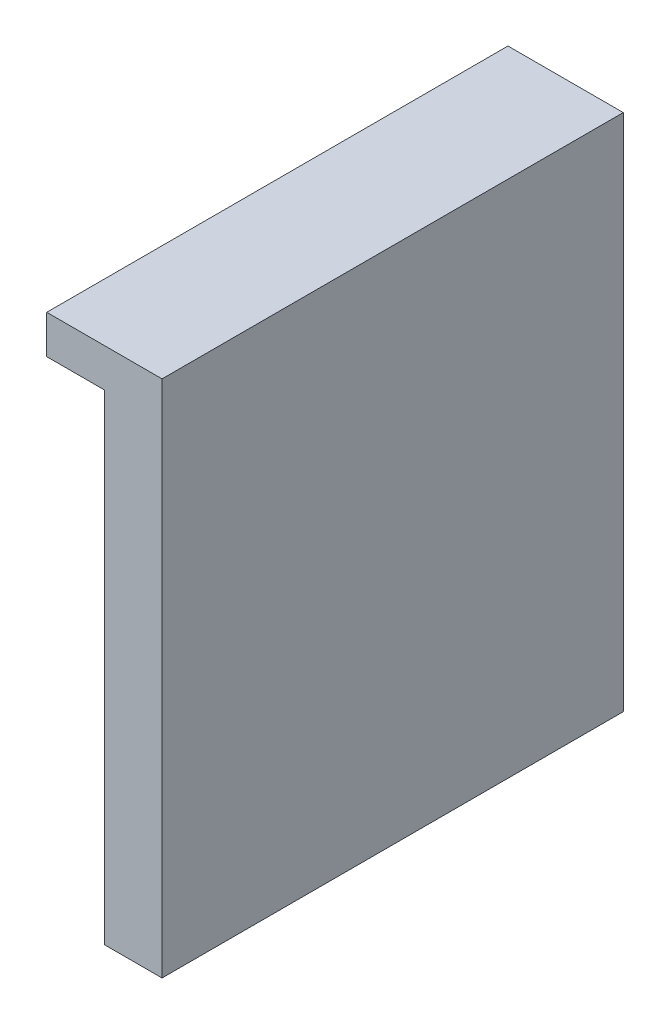
from build123d import *

# Parameters (mm, degrees)
SKETCH1_W           = 3
SKETCH1_H           = 24
BOSS_EXTRUDE1_DEPTH = 23
SKETCH2_W           = 6
SKETCH2_H           = 24
BOSS_EXTRUDE2_DEPTH = 2
SKETCH3_W           = 22
SKETCH3_H           = 9
CUT_EXTRUDE1_DEPTH  = 1
SKETCH4_W           = 3
SKETCH4_H           = 24
BOSS_EXTRUDE3_DEPTH = 2


with BuildPart() as part:
    # Sketch1 → Boss-Extrude1 (new body)
    with BuildSketch(Plane(origin=(0, 0, 0), x_dir=(1, 0, 0), z_dir=(0, 1, 0))):
        with Locations((1.5, 12)):
            Rectangle(SKETCH1_W, SKETCH1_H)
    extrude(amount=BOSS_EXTRUDE1_DEPTH)

    # Sketch2 → Boss-Extrude2 (add)
    with BuildSketch(Plane(origin=(0, 23, 0), x_dir=(1, 0, 0), z_dir=(0, 1, 0))):
        with Locations((0, 12)):
            Rectangle(SKETCH2_W, SKETCH2_H)
    extrude(amount=BOSS_EXTRUDE2_DEPTH)

    # Sketch3 → Cut-Extrude1 (cut)
    with BuildSketch(Plane.ZY):
        with Locations((-12, 16.5)):
            Rectangle(SKETCH3_W, SKETCH3_H)
    extrude(amount=-CUT_EXTRUDE1_DEPTH, mode=Mode.SUBTRACT)

    # Sketch4 → Boss-Extrude3 (add)
    with BuildSketch(Plane.XZ):
        with Locations((1.5, -12)):
            Rectangle(SKETCH4_W, SKETCH4_H)
    extrude(amount=BOSS_EXTRUDE3_DEPTH)


solid = part.part
